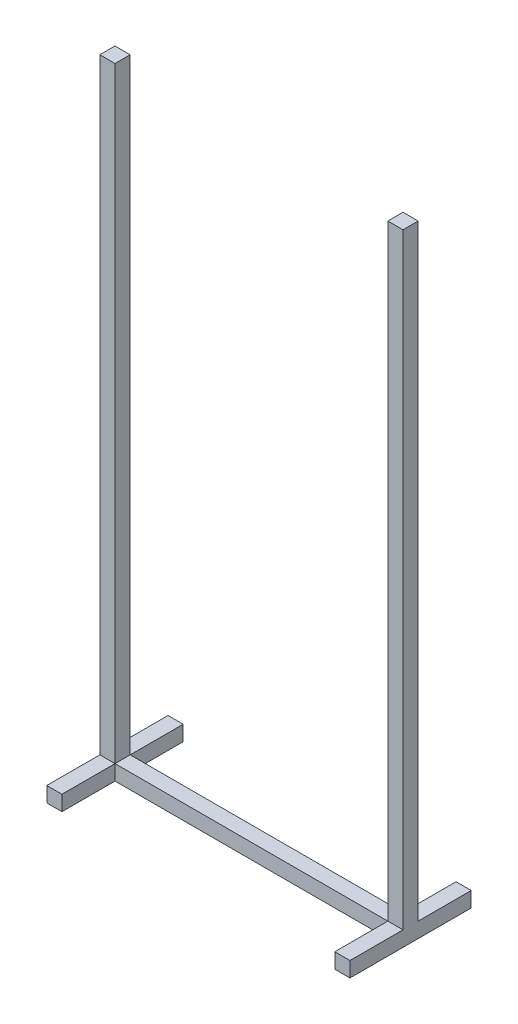
from build123d import *

# Parameters (mm, degrees)
SKETCH_1_W      = 10
SKETCH_1_H      = 10
SKETCH_1_W_2    = 180
SKETCH_1_H_2    = 35
EXTRUDE_1_DEPTH = 10
SKETCH_2_W      = 10
SKETCH_2_H      = 10
EXTRUDE_2_DEPTH = 400


with BuildPart() as part:
    # 草图1 → 凸台-拉伸1 (new body)
    with BuildSketch(Plane(origin=(0, 0, 0), x_dir=(1, 0, 0), z_dir=(0, 1, 0))):
        with Locations((-95, 0)):
            Rectangle(SKETCH_1_W, SKETCH_1_H)
        Rectangle(SKETCH_1_W_2, SKETCH_1_H)
        with Locations((-95, -22.5)):
            Rectangle(SKETCH_1_W, SKETCH_1_H_2)
        with Locations((-95, 22.5)):
            Rectangle(SKETCH_1_W, SKETCH_1_H_2)
        with Locations((95, 22.5)):
            Rectangle(SKETCH_1_W, SKETCH_1_H_2)
        with Locations((95, 0)):
            Rectangle(SKETCH_1_W, SKETCH_1_H)
        with Locations((95, -22.5)):
            Rectangle(SKETCH_1_W, SKETCH_1_H_2)
    extrude(amount=EXTRUDE_1_DEPTH)

    # 草图2 → 凸台-拉伸2 (add)
    with BuildSketch(Plane(origin=(0, 10, 0), x_dir=(1, 0, 0), z_dir=(0, 1, 0))):
        with Locations((-95, 0)):
            Rectangle(SKETCH_2_W, SKETCH_2_H)
        with Locations((95, 0)):
            Rectangle(SKETCH_2_W, SKETCH_2_H)
    extrude(amount=EXTRUDE_2_DEPTH)


solid = part.part
